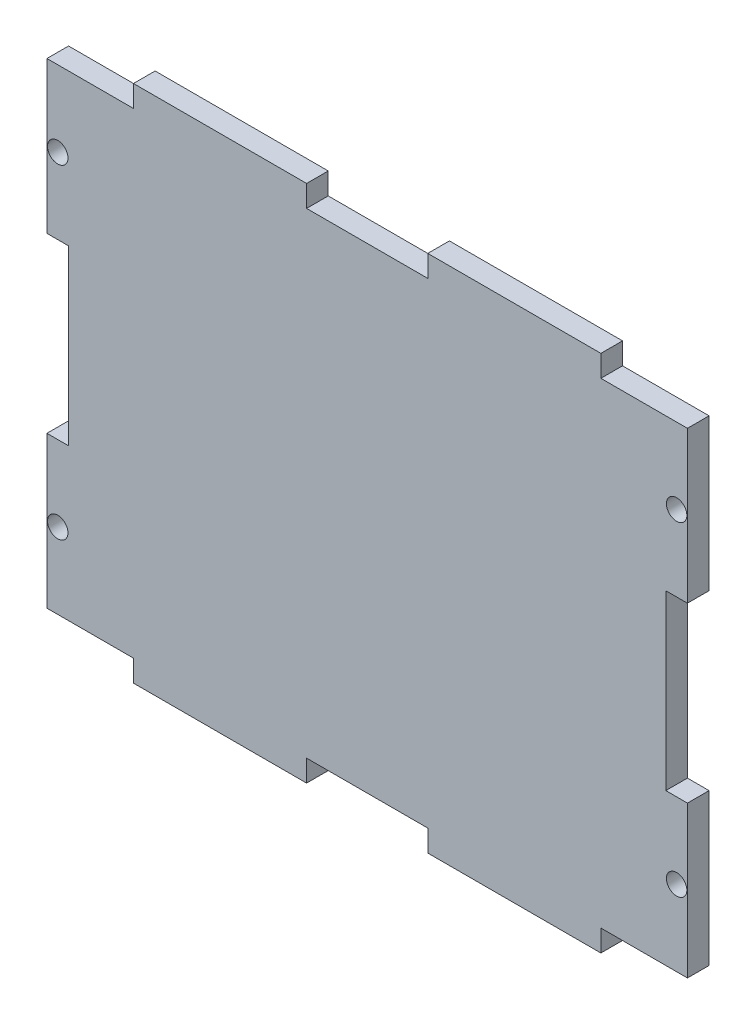
from build123d import *

# Parameters (mm, degrees)
SKETCH1_W           = 93.98
SKETCH1_H           = 76.2
BOSS_EXTRUDE1_DEPTH = 3.175
SKETCH2_W           = 12.7
SKETCH2_H           = 3.175
SKETCH2_W_2         = 17.78
CUT_EXTRUDE1_DEPTH  = 61.578467503
SKETCH3_W           = 3.175
SKETCH3_H           = 25.4
CUT_EXTRUDE2_DEPTH  = 61.578467503
SKETCH4_R           = 1.5
CUT_EXTRUDE3_DEPTH  = 61.578467503


with BuildPart() as part:
    # Sketch1 → Boss-Extrude1 (new body)
    with BuildSketch(Plane.XY):
        Rectangle(SKETCH1_W, SKETCH1_H)
    extrude(amount=BOSS_EXTRUDE1_DEPTH)

    # Sketch2 → Cut-Extrude1 (cut, through all)
    with BuildSketch(Plane.XY.offset(3.175)):
        with Locations((40.64, 36.5125)):
            Rectangle(SKETCH2_W, SKETCH2_H)
        with Locations((-40.64, -36.5125)):
            Rectangle(SKETCH2_W, SKETCH2_H)
        with Locations((0, -36.5125)):
            Rectangle(SKETCH2_W_2, SKETCH2_H)
        with Locations((40.64, -36.5125)):
            Rectangle(SKETCH2_W, SKETCH2_H)
        with Locations((0, 36.5125)):
            Rectangle(SKETCH2_W_2, SKETCH2_H)
        with Locations((-40.64, 36.5125)):
            Rectangle(SKETCH2_W, SKETCH2_H)
    extrude(amount=-CUT_EXTRUDE1_DEPTH, mode=Mode.SUBTRACT)

    # Sketch3 → Cut-Extrude2 (cut, through all)
    with BuildSketch(Plane(origin=(0, 0, 0), x_dir=(-1, 0, 0), z_dir=(0, 0, -1))):
        with Locations((-45.4025, 0)):
            Rectangle(SKETCH3_W, SKETCH3_H)
        with Locations((45.4025, 0)):
            Rectangle(SKETCH3_W, SKETCH3_H)
    extrude(amount=-CUT_EXTRUDE2_DEPTH, mode=Mode.SUBTRACT)

    # Sketch4 → Cut-Extrude3 (cut, through all)
    with BuildSketch(Plane(origin=(0, 0, 0), x_dir=(-1, 0, 0), z_dir=(0, 0, -1))):
        with Locations((-45.4025, 23.8125)):
            Circle(SKETCH4_R)
        with Locations(Location((-45.4025, -23.8125, 0), (0, 0, 180))):
            Circle(SKETCH4_R)
        with Locations((45.4025, -23.8125)):
            Circle(SKETCH4_R)
        with Locations(Location((45.4025, 23.8125, 0), (0, 0, 180))):
            Circle(SKETCH4_R)
    extrude(amount=-CUT_EXTRUDE3_DEPTH, mode=Mode.SUBTRACT)


solid = part.part
